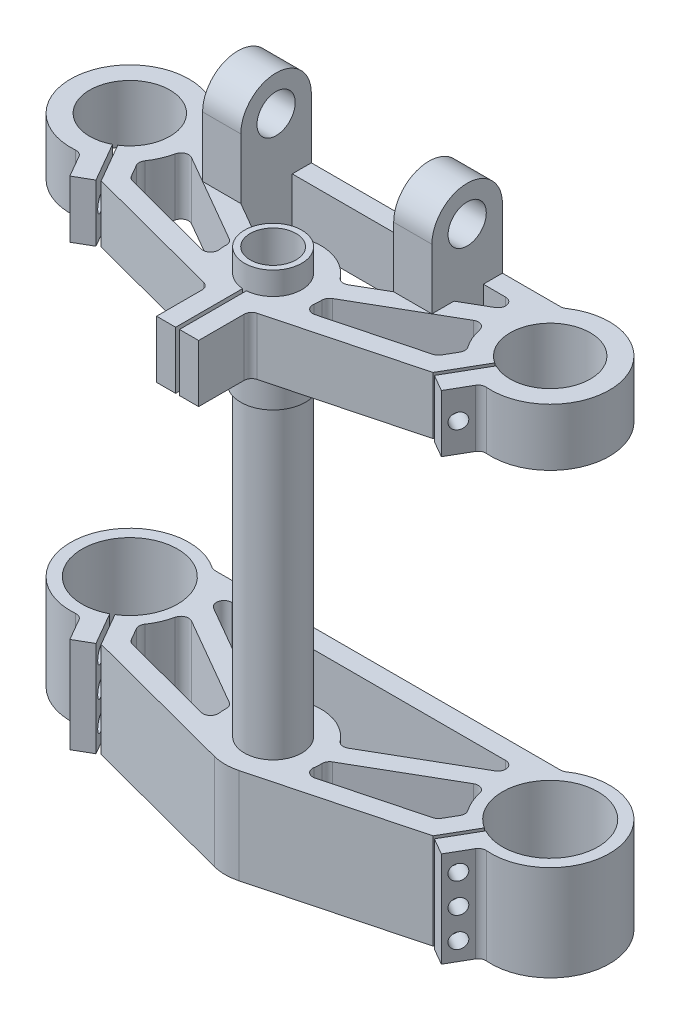
from build123d import *

# Parameters (mm, degrees)
BOSS_EXTRUDE1_DEPTH     = 130
CUT_EXTRUDE2_DEPTH      = 203.822582569
CUT_EXTRUDE2_DEPTH_BACK = 203.822582569
SKETCH3_W               = 282
SKETCH3_H               = 180
CUT_EXTRUDE3_START      = -23.671244
SKETCH4_R               = 4
CUT_EXTRUDE3_DEPTH      = 23.671244
BOSS_EXTRUDE2_DEPTH     = 50
SKETCH6_R               = 25
CUT_EXTRUDE4_DEPTH      = 50
SKETCH7_R               = 4
CUT_EXTRUDE5_DEPTH      = 10
SKETCH9_W               = 20
SKETCH9_H               = 36.905989232
BOSS_EXTRUDE3_DEPTH     = 80
CUT_EXTRUDE6_DEPTH      = 238.985293663
CUT_EXTRUDE6_DEPTH_BACK = 238.985293663
SKETCH10_R              = 10


with BuildPart() as part:
    # Sketch1 → Boss-Extrude1 (new, symmetric)
    with BuildSketch(Plane(origin=(0, 0, 0), x_dir=(1, 0, 0), z_dir=(0, 1, 0))):
        with BuildLine():
            Line((-13.981417011, -22.341004042), (-86.812006606, -3.162782684))
            Line((-86.812006606, -3.162782684), (-98.645886115, 17.334097875))
            ThreePointArc((-98.645886115, 17.334097875), (-120.5, 53.186533479), (-100.377936922, 16.334097875))
            Line((-100.377936922, 16.334097875), (-88.544057413, -4.162782684))
            Line((-88.544057413, -4.162782684), (-97.204311451, -9.162782684))
            Line((-97.204311451, -9.162782684), (-103.714891141, 2.113872125))
            ThreePointArc((-103.714891141, 2.113872125), (-105.320337505, 3.655820834), (-107.501393584, 4.100858168))
            ThreePointArc((-107.501393584, 4.100858168), (-139.983606374, 42.872950452), (-92.643615537, 60.685714286))
            ThreePointArc((-92.643615537, 60.685714286), (-91.575162145, 60.17526845), (-90.404082058, 60))
            Line((-90.404082058, 60), (90.404082058, 60))
            ThreePointArc((90.404082058, 60), (91.575162145, 60.17526845), (92.643615537, 60.685714286))
            ThreePointArc((92.643615537, 60.685714286), (139.983606374, 42.872950452), (107.501393584, 4.100858168))
            ThreePointArc((107.501393584, 4.100858168), (105.320337505, 3.655820834), (103.714891141, 2.113872125))
            Line((103.714891141, 2.113872125), (97.204311451, -9.162782684))
            Line((97.204311451, -9.162782684), (88.544057413, -4.162782684))
            Line((88.544057413, -4.162782684), (100.377936922, 16.334097875))
            ThreePointArc((100.377936922, 16.334097875), (120.5, 53.186533479), (98.645886115, 17.334097875))
            Line((98.645886115, 17.334097875), (86.812006606, -3.162782684))
            Line((86.812006606, -3.162782684), (13.981417011, -22.341004042))
            ThreePointArc((13.981417011, -22.341004042), (11.831851333, -23.767250184), (11, -26.209141668))
            Line((11, -26.209141668), (11, -50))
            Line((11, -50), (1, -50))
            Line((1, -50), (1, -14.966629547))
            ThreePointArc((1, -14.966629547), (0, 15), (-1, -14.966629547))
            Line((-1, -14.966629547), (-1, -50))
            Line((-1, -50), (-11, -50))
            Line((-11, -50), (-11, -26.209141668))
            ThreePointArc((-11, -26.209141668), (-11.831851333, -23.767250184), (-13.981417011, -22.341004042))
        make_face()
        with BuildLine():
            Line((-71.674337148, 50), (71.674337148, 50))
            ThreePointArc((71.674337148, 50), (75.538040453, 47.03527618), (73.674337148, 42.535898385))
            Line((73.674337148, 42.535898385), (24.874685928, 14.361406616))
            ThreePointArc((24.874685928, 14.361406616), (22.108987856, 13.899478881), (19.719556834, 15.366817441))
            ThreePointArc((19.719556834, 15.366817441), (0, 25), (-19.719556834, 15.366817441))
            ThreePointArc((-19.719556834, 15.366817441), (-22.108987856, 13.899478881), (-24.874685928, 14.361406616))
            Line((-24.874685928, 14.361406616), (-73.674337148, 42.535898385))
            ThreePointArc((-73.674337148, 42.535898385), (-75.538040453, 47.03527618), (-71.674337148, 50))
        make_face(mode=Mode.SUBTRACT)
        with BuildLine():
            Line((-29.74399867, -7.849405511), (-78.623450864, 5.021847615))
            ThreePointArc((-78.623450864, 5.021847615), (-80.033056472, 5.711321978), (-81.06896949, 6.889985241))
            Line((-81.06896949, 6.889985241), (-84.662332258, 13.113872125))
            ThreePointArc((-84.662332258, 13.113872125), (-85.194975829, 15.275203815), (-84.489861426, 17.386572453))
            ThreePointArc((-84.489861426, 17.386572453), (-81.553975288, 22.678324867), (-79.702118637, 28.439635305))
            ThreePointArc((-79.702118637, 28.439635305), (-77.412719914, 31.250401015), (-73.792714591, 31.057238249))
            Line((-73.792714591, 31.057238249), (-26.994317448, 4.038171061))
            ThreePointArc((-26.994317448, 4.038171061), (-25.510589067, 2.53968298), (-24.995101248, 0.494887454))
            ThreePointArc((-24.995101248, 0.494887454), (-24.956556675, -1.473186661), (-24.76328938, -3.432127487))
            ThreePointArc((-24.76328938, -3.432127487), (-26.071324858, -6.97389247), (-29.74399867, -7.849405511))
        make_face(mode=Mode.SUBTRACT)
        with BuildLine():
            Line((81.06896949, 6.889985241), (84.662332258, 13.113872125))
            ThreePointArc((84.662332258, 13.113872125), (85.194975829, 15.275203815), (84.489861426, 17.386572453))
            ThreePointArc((84.489861426, 17.386572453), (81.553975288, 22.678324867), (79.702118637, 28.439635305))
            ThreePointArc((79.702118637, 28.439635305), (77.412719914, 31.250401015), (73.792714591, 31.057238249))
            Line((73.792714591, 31.057238249), (26.994317448, 4.038171061))
            ThreePointArc((26.994317448, 4.038171061), (25.510589067, 2.53968298), (24.995101248, 0.494887454))
            ThreePointArc((24.995101248, 0.494887454), (24.956556675, -1.473186661), (24.76328938, -3.432127487))
            ThreePointArc((24.76328938, -3.432127487), (26.071324858, -6.97389247), (29.74399867, -7.849405511))
            Line((29.74399867, -7.849405511), (78.623450864, 5.021847615))
            ThreePointArc((78.623450864, 5.021847615), (80.033056472, 5.711321978), (81.06896949, 6.889985241))
        make_face(mode=Mode.SUBTRACT)
    extrude(amount=BOSS_EXTRUDE1_DEPTH, both=True)

    # Sketch3 → Cut-Extrude2 (cut, two sides: drawn at the far end of the back side and taken through both)
    with BuildSketch(Plane.XY.offset(-CUT_EXTRUDE2_DEPTH_BACK)):
        with Locations((0, 10)):
            Rectangle(SKETCH3_W, SKETCH3_H)
    extrude(amount=CUT_EXTRUDE2_DEPTH + CUT_EXTRUDE2_DEPTH_BACK, mode=Mode.SUBTRACT)


with BuildPart() as cut_extrude2_piece_1:
    # of the separate pieces the step leaves, piece 1, a body of its own (cut_extrude2_pieces)
    add(part.part.solids().sort_by_distance((-1, -130, 14.966629547))[0])


with BuildPart() as cut_extrude2_piece_2:
    # of the separate pieces the step leaves, piece 2, a body of its own (cut_extrude2_pieces)
    add(part.part.solids().sort_by_distance((-1, 100, 14.966629547))[0])


with BuildPart() as cut_extrude3_tool:
    # Sketch4 → Cut-Extrude3 (new body)
    with BuildSketch(Plane(origin=(-76.870834875, 0, 44.381397208), x_dir=(0.4999999999999983, 0, 0.8660254037844396), z_dir=(-0.8660254037844396, 0, 0.4999999999999983)).offset(CUT_EXTRUDE3_START)):
        with Locations(Location((-47.177532841, 115, 0), (0, 0, 331.544801467))):
            Circle(SKETCH4_R)
        with Locations(Location((-47.177532841, -89.5, 0), (0, 0, 28.455198533))):
            Circle(SKETCH4_R)
        with Locations(Location((-47.177532841, -105, 0), (0, 0, 331.544801467))):
            Circle(SKETCH4_R)
        with Locations(Location((-47.177532841, -120.5, 0), (0, 0, 331.544801467))):
            Circle(SKETCH4_R)
    cut_extrude3 = extrude(amount=CUT_EXTRUDE3_DEPTH)


with BuildPart() as cut_extrude2_piece_1_1:
    add(cut_extrude2_piece_1.part)

    # Cut-Extrude3: cut by cut_extrude3_tool
    add(cut_extrude3_tool.part, mode=Mode.SUBTRACT)

    # Sketch5 → Boss-Extrude2 (add)
    with BuildSketch(Plane.XZ.offset(130)):
        with BuildLine():
            Line((-1, 14.966629547), (-1, 25.144951116))
            ThreePointArc((-1, 25.144951116), (0, 25.164827967), (1, 25.144951116))
            Line((1, 25.144951116), (1, 14.966629547))
            ThreePointArc((1, 14.966629547), (0, 15), (-1, 14.966629547))
        make_face()
    extrude(amount=-BOSS_EXTRUDE2_DEPTH)

    # Sketch6 → Cut-Extrude4 (cut)
    with BuildSketch(Plane.XZ.offset(130)):
        with Locations((110, -35)):
            Circle(SKETCH6_R)
        with Locations((-110, -35)):
            Circle(SKETCH6_R)
        with BuildLine():
            Line((-13.981417011, 22.341004042), (-6.408116422, 24.335254479))
            ThreePointArc((-6.408116422, 24.335254479), (0, 25.164827967), (6.408116422, 24.335254479))
            Line((6.408116422, 24.335254479), (13.981417011, 22.341004042))
            Line((13.981417011, 22.341004042), (13.981417011, 50))
            Line((13.981417011, 50), (-13.981417011, 50))
            Line((-13.981417011, 50), (-13.981417011, 22.341004042))
        make_face()
    extrude(amount=-CUT_EXTRUDE4_DEPTH, mode=Mode.SUBTRACT)


with BuildPart() as cut_extrude2_piece_2_1:
    add(cut_extrude2_piece_2.part)

    # Cut-Extrude3: cut by cut_extrude3_tool
    add(cut_extrude3_tool.part, mode=Mode.SUBTRACT)

    # Sketch7 → Cut-Extrude5 (cut)
    with BuildSketch(Plane.ZY.offset(11)):
        with Locations((38.104570834, 115)):
            Circle(SKETCH7_R)
    extrude(amount=-CUT_EXTRUDE5_DEPTH, mode=Mode.SUBTRACT)


with BuildPart() as mirror1_tool:
    # Mirror1: Cut-Extrude3 across plane
    add(cut_extrude3.mirror(Plane(origin=(0, 0, 0), x_dir=(0, 0, 1), z_dir=(1, 0, 0))))


with BuildPart() as cut_extrude2_piece_1_2:
    add(cut_extrude2_piece_1_1.part)

    # Mirror1: cut by mirror1_tool
    add(mirror1_tool.part, mode=Mode.SUBTRACT)


with BuildPart() as cut_extrude2_piece_2_2:
    add(cut_extrude2_piece_2_1.part)

    # Mirror1: cut by mirror1_tool
    add(mirror1_tool.part, mode=Mode.SUBTRACT)

    # Sketch9 → Boss-Extrude3 (add)
    with BuildSketch(Plane.XZ.offset(-100)):
        with Locations((-50, -41.547005384)):
            Rectangle(SKETCH9_W, SKETCH9_H)
        with Locations((50, -41.547005384)):
            Rectangle(SKETCH9_W, SKETCH9_H)
    extrude(amount=-BOSS_EXTRUDE3_DEPTH)

    # Sketch10 → Cut-Extrude6 (cut, two sides: drawn at the far end of the back side and taken through both)
    with BuildSketch(Plane(origin=(0, 0, 0), x_dir=(0, 0, -1), z_dir=(1, 0, 0)).offset(-CUT_EXTRUDE6_DEPTH_BACK)):
        with BuildLine():
            ThreePointArc((41.547005384, 180), (54.59524301, 174.59524301), (60, 161.547005384))
            Line((60, 161.547005384), (60, 180))
            Line((60, 180), (41.547005384, 180))
        make_face()
        with BuildLine():
            ThreePointArc((23.094010768, 161.547005384), (28.498767757, 174.59524301), (41.547005384, 180))
            Line((41.547005384, 180), (23.094010768, 180))
            Line((23.094010768, 180), (23.094010768, 161.547005384))
        make_face()
        with Locations((41.547005384, 161.547005384)):
            Circle(SKETCH10_R)
    extrude(amount=CUT_EXTRUDE6_DEPTH + CUT_EXTRUDE6_DEPTH_BACK, mode=Mode.SUBTRACT)


with BuildPart() as body_3:
    # Sketch8 → Revolve1 (revolve)
    with BuildSketch(Plane.XY, mode=Mode.PRIVATE) as revolve1_sk:
        Polygon((-15, -130), (-15, 80), (-17, 80), (-17, 100), (-15, 100), (-15, 142), (-12, 142), (-12, -130), align=None)
    revolve(revolve1_sk.sketch.rotate(Axis((0, 0, 0), (0, 1, 0)), 270), axis=Axis((0, 0, 0), (0, 1, 0)))


solid = Compound([cut_extrude2_piece_1_2.part, cut_extrude2_piece_2_2.part, body_3.part])
